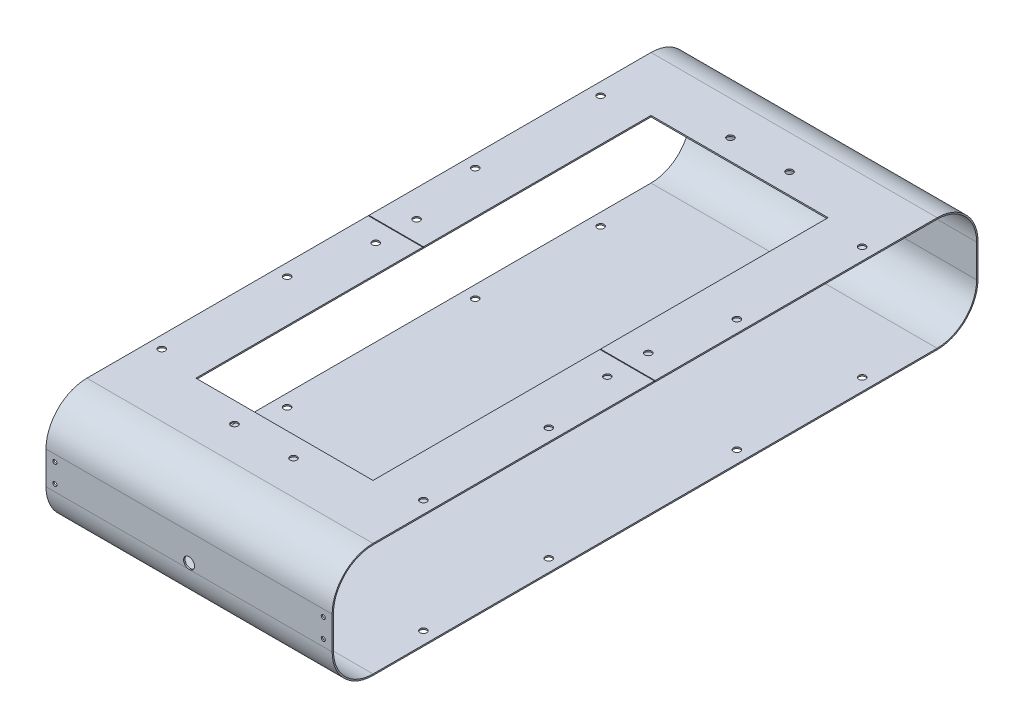
from build123d import *

# Parameters (mm, degrees)
SALIENTE_EXTRUIR1_DEPTH = 110
VACIADO2_T              = -1
CORTAR_EXTRUIR1_START   = -10
CORTAR_EXTRUIR1_DEPTH   = 10
CROQUIS8_R              = 1.5
CORTAR_EXTRUIR4_DEPTH   = 5
CROQUIS9_R              = 4
CORTAR_EXTRUIR5_DEPTH   = 5
CROQUIS10_R             = 2.5
CORTAR_EXTRUIR6_DEPTH   = 275.454003432
CROQUIS11_W             = 130
CROQUIS11_H             = 334
CORTAR_EXTRUIR7_DEPTH   = 8
CROQUIS12_R             = 2.5
CORTAR_EXTRUIR8_DEPTH   = 8
CROQUIS13_W             = 40
CROQUIS13_H             = 0.5
CORTAR_EXTRUIR9_DEPTH   = 1
CROQUIS14_R             = 2.5
CORTAR_EXTRUIR10_DEPTH  = 1


with BuildPart() as part:
    # Croquis1 → Saliente-Extruir1 (new, symmetric)
    with BuildSketch(Plane(origin=(0, 0, 0), x_dir=(0, 0, -1), z_dir=(1, 0, 0))):
        with BuildLine():
            Line((207, -42), (-207, -42))
            ThreePointArc((-207, -42), (-228.213203436, -33.213203436), (-237, -12))
            Line((-237, -12), (-237, 12))
            ThreePointArc((-237, 12), (-228.213203436, 33.213203436), (-207, 42))
            Line((-207, 42), (207, 42))
            ThreePointArc((207, 42), (228.213203436, 33.213203436), (237, 12))
            Line((237, 12), (237, -12))
            ThreePointArc((237, -12), (228.213203436, -33.213203436), (207, -42))
        make_face()
    extrude(amount=SALIENTE_EXTRUIR1_DEPTH, both=True)

    # Vaciado2
    vaciado2_openings = [part.faces().sort_by_distance(p)[0] for p in [
        (110, 0, 0),
    ]]
    offset(amount=VACIADO2_T, openings=vaciado2_openings, kind=Kind.INTERSECTION)

    # Croquis6 → Cortar-Extruir1 (cut)
    with BuildSketch(Plane.ZY.offset(110).offset(CORTAR_EXTRUIR1_START)):
        with BuildLine():
            Line((207, 42), (-207, 42))
            ThreePointArc((-207, 42), (-228.213203436, 33.213203436), (-237, 12))
            Line((-237, 12), (-237, -12))
            ThreePointArc((-237, -12), (-228.213203436, -33.213203436), (-207, -42))
            Line((-207, -42), (207, -42))
            ThreePointArc((207, -42), (228.213203436, -33.213203436), (237, -12))
            Line((237, -12), (237, 12))
            ThreePointArc((237, 12), (228.213203436, 33.213203436), (207, 42))
        make_face()
    extrude(amount=CORTAR_EXTRUIR1_DEPTH, mode=Mode.SUBTRACT)

    # Croquis8 → Cortar-Extruir4 (cut)
    with BuildSketch(Plane.XY.offset(237)):
        with Locations((103.5, 7)):
            Circle(CROQUIS8_R)
        with Locations((103.5, -7)):
            Circle(CROQUIS8_R)
        with Locations(Location((-93.5, -7, 0), (0, 0, 90))):
            Circle(CROQUIS8_R)
        with Locations(Location((-93.5, 7, 0), (0, 0, 90))):
            Circle(CROQUIS8_R)
    extrude(amount=-CORTAR_EXTRUIR4_DEPTH, mode=Mode.SUBTRACT)

    # Croquis9 → Cortar-Extruir5 (cut)
    with BuildSketch(Plane.XY.offset(237)):
        with Locations(Location((5, -8, 0), (0, 0, 270))):
            Circle(CROQUIS9_R)
    extrude(amount=-CORTAR_EXTRUIR5_DEPTH, mode=Mode.SUBTRACT)

    # Croquis10 → Cortar-Extruir6 (cut, through all)
    with BuildSketch(Plane(origin=(0, 42, 0), x_dir=(1, 0, 0), z_dir=(0, 1, 0))):
        with Locations(Location((101, 161.01, 0), (0, 0, 270))):
            Circle(CROQUIS10_R)
        with Locations(Location((101, 69.01, 0), (0, 0, 270))):
            Circle(CROQUIS10_R)
        with Locations(Location((-91, 69.01, 0), (0, 0, 270))):
            Circle(CROQUIS10_R)
        with Locations(Location((-91, 161.01, 0), (0, 0, 270))):
            Circle(CROQUIS10_R)
        with Locations(Location((101, -69.01, 0), (0, 0, 270))):
            Circle(CROQUIS10_R)
        with Locations(Location((101, -161.01, 0), (0, 0, 270))):
            Circle(CROQUIS10_R)
        with Locations(Location((-91, -161.01, 0), (0, 0, 270))):
            Circle(CROQUIS10_R)
        with Locations(Location((-91, -69.01, 0), (0, 0, 270))):
            Circle(CROQUIS10_R)
    extrude(amount=-CORTAR_EXTRUIR6_DEPTH, mode=Mode.SUBTRACT)

    # Croquis11 → Cortar-Extruir7 (cut)
    with BuildSketch(Plane(origin=(0, 42, 0), x_dir=(1, 0, 0), z_dir=(0, 1, 0))):
        with Locations((5, 0)):
            Rectangle(CROQUIS11_W, CROQUIS11_H)
    extrude(amount=-CORTAR_EXTRUIR7_DEPTH, mode=Mode.SUBTRACT)

    # Croquis12 → Cortar-Extruir8 (cut)
    with BuildSketch(Plane(origin=(0, 42, 0), x_dir=(1, 0, 0), z_dir=(0, 1, 0))):
        with Locations(Location((-16.666666667, 182, 0), (0, 0, 270))):
            Circle(CROQUIS12_R)
        with Locations(Location((26.666666667, 182, 0), (0, 0, 270))):
            Circle(CROQUIS12_R)
        with Locations(Location((26.666666667, -182, 0), (0, 0, 90))):
            Circle(CROQUIS12_R)
        with Locations(Location((-16.666666667, -182, 0), (0, 0, 90))):
            Circle(CROQUIS12_R)
    extrude(amount=-CORTAR_EXTRUIR8_DEPTH, mode=Mode.SUBTRACT)

    # Croquis13 → Cortar-Extruir9 (cut)
    with BuildSketch(Plane(origin=(0, 42, 0), x_dir=(1, 0, 0), z_dir=(0, 1, 0))):
        with Locations((-80, -0.25)):
            Rectangle(CROQUIS13_W, CROQUIS13_H)
        with Locations((90, -0.25)):
            Rectangle(CROQUIS13_W, CROQUIS13_H)
    extrude(amount=-CORTAR_EXTRUIR9_DEPTH, mode=Mode.SUBTRACT)

    # Croquis14 → Cortar-Extruir10 (cut)
    with BuildSketch(Plane(origin=(0, 42, 0), x_dir=(1, 0, 0), z_dir=(0, 1, 0))):
        with Locations(Location((90, 15, 0), (0, 0, 270))):
            Circle(CROQUIS14_R)
        with Locations(Location((90, -15, 0), (0, 0, 270))):
            Circle(CROQUIS14_R)
        with Locations(Location((-80, -15, 0), (0, 0, 90))):
            Circle(CROQUIS14_R)
        with Locations(Location((-80, 15, 0), (0, 0, 90))):
            Circle(CROQUIS14_R)
    extrude(amount=-CORTAR_EXTRUIR10_DEPTH, mode=Mode.SUBTRACT)


solid = part.part
